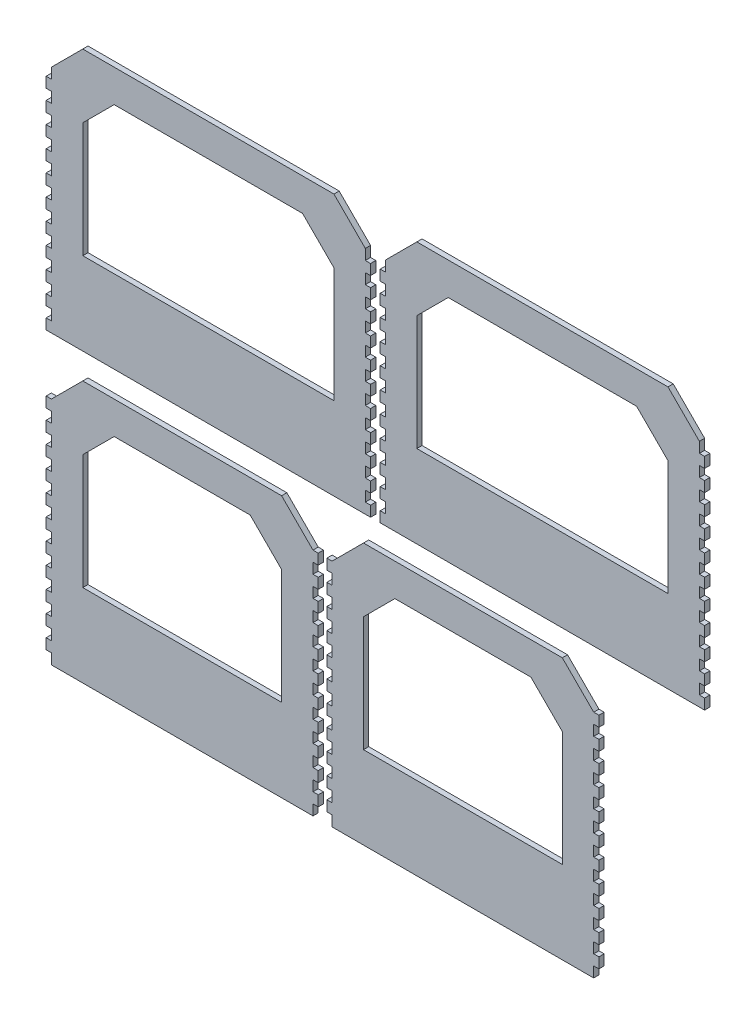
from build123d import *

# Parameters (mm, degrees)
AUFSATZ_LINEAR_AUSTRAGEN9_DEPTH   = 5
AUFSATZ_LINEAR_AUSTRAGEN9_2_DEPTH = 5
AUFSATZ_LINEAR_AUSTRAGEN9_3_DEPTH = 5
AUFSATZ_LINEAR_AUSTRAGEN9_4_DEPTH = 5


with BuildPart() as part:
    # Skizze1 → Aufsatz-Linear austragen9 (new body)
    with BuildSketch(Plane.XY):
        Polygon((430.89618142, 326.340211581), (430.89618142, 336.340211581), (425.89618142, 336.340211581), (425.89618142, 346.340211581), (430.89618142, 346.340211581), (430.89618142, 356.340211581), (425.89618142, 356.340211581), (425.89618142, 366.340211581), (430.89618142, 366.340211581), (430.89618142, 376.340211581), (425.89618142, 376.340211581), (425.89618142, 386.340211581), (430.89618142, 386.340211581), (430.89618142, 396.340211581), (425.89618142, 396.340211581), (425.89618142, 406.340211581), (430.89618142, 406.340211581), (430.89618142, 416.340211581), (425.89618142, 416.340211581), (425.89618142, 426.340211581), (430.89618142, 426.340211581), (430.89618142, 436.340211581), (425.89618142, 436.340211581), (425.89618142, 446.340211581), (430.89618142, 446.340211581), (430.89618142, 456.340211581), (425.89618142, 456.340211581), (425.89618142, 466.340211581), (430.89618142, 466.340211581), (430.89618142, 476.340211581), (425.89618142, 476.340211581), (425.89618142, 486.340211581), (430.89618142, 486.340211581), (430.89618142, 496.340211581), (425.89618142, 496.340211581), (425.89618142, 506.340211581), (430.89618142, 506.340211581), (430.89618142, 516.340211581), (425.89618142, 516.340211581), (425.89618142, 526.340211581), (430.89618142, 526.340211581), (430.89618142, 536.340211581), (460.89618142, 566.340211581), (700.89618142, 566.340211581), (730.89618142, 536.340211581), (730.89618142, 526.340211581), (735.89618142, 526.340211581), (735.89618142, 516.340211581), (730.89618142, 516.340211581), (730.89618142, 506.340211581), (735.89618142, 506.340211581), (735.89618142, 496.340211581), (730.89618142, 496.340211581), (730.89618142, 486.340211581), (735.89618142, 486.340211581), (735.89618142, 476.340211581), (730.89618142, 476.340211581), (730.89618142, 466.340211581), (735.89618142, 466.340211581), (735.89618142, 456.340211581), (730.89618142, 456.340211581), (730.89618142, 446.340211581), (735.89618142, 446.340211581), (735.89618142, 436.340211581), (730.89618142, 436.340211581), (730.89618142, 426.340211581), (735.89618142, 426.340211581), (735.89618142, 416.340211581), (730.89618142, 416.340211581), (730.89618142, 406.340211581), (735.89618142, 406.340211581), (735.89618142, 396.340211581), (730.89618142, 396.340211581), (730.89618142, 386.340211581), (735.89618142, 386.340211581), (735.89618142, 376.340211581), (730.89618142, 376.340211581), (730.89618142, 366.340211581), (735.89618142, 366.340211581), (735.89618142, 356.340211581), (730.89618142, 356.340211581), (730.89618142, 346.340211581), (735.89618142, 346.340211581), (735.89618142, 336.340211581), (730.89618142, 336.340211581), (730.89618142, 326.340211581), (735.89618142, 326.340211581), (735.89618142, 316.340211581), (730.89618142, 316.340211581), (430.89618142, 316.340211581), (425.89618142, 316.340211581), (425.89618142, 326.340211581), align=None)
        Polygon((700.89618142, 505.311376979), (670.89618142, 535.311376979), (490.89618142, 535.311376979), (460.89618142, 505.311376979), (460.89618142, 395.311376979), (700.89618142, 395.311376979), align=None, mode=Mode.SUBTRACT)
    extrude(amount=AUFSATZ_LINEAR_AUSTRAGEN9_DEPTH)


with BuildPart() as body_2:
    # Skizze1 → Aufsatz-Linear austragen9 2 (new body)
    with BuildSketch(Plane.XY):
        Polygon((1055.129449928, 316.340211581), (1055.129449928, 326.340211581), (1050.129449928, 326.340211581), (1050.129449928, 336.340211581), (1055.129449928, 336.340211581), (1055.129449928, 346.340211581), (1050.129449928, 346.340211581), (1050.129449928, 356.340211581), (1055.129449928, 356.340211581), (1055.129449928, 366.340211581), (1050.129449928, 366.340211581), (1050.129449928, 376.340211581), (1055.129449928, 376.340211581), (1055.129449928, 386.340211581), (1050.129449928, 386.340211581), (1050.129449928, 396.340211581), (1055.129449928, 396.340211581), (1055.129449928, 406.340211581), (1050.129449928, 406.340211581), (1050.129449928, 416.340211581), (1055.129449928, 416.340211581), (1055.129449928, 426.340211581), (1050.129449928, 426.340211581), (1050.129449928, 436.340211581), (1055.129449928, 436.340211581), (1055.129449928, 446.340211581), (1050.129449928, 446.340211581), (1050.129449928, 456.340211581), (1055.129449928, 456.340211581), (1055.129449928, 466.340211581), (1050.129449928, 466.340211581), (1050.129449928, 476.340211581), (1055.129449928, 476.340211581), (1055.129449928, 486.340211581), (1050.129449928, 486.340211581), (1050.129449928, 496.340211581), (1055.129449928, 496.340211581), (1055.129449928, 506.340211581), (1050.129449928, 506.340211581), (1050.129449928, 516.340211581), (1055.129449928, 516.340211581), (1055.129449928, 526.340211581), (1050.129449928, 526.340211581), (1050.129449928, 536.340211581), (1020.129449928, 566.340211581), (780.129449928, 566.340211581), (750.129449928, 536.340211581), (750.129449928, 526.340211581), (745.129449928, 526.340211581), (745.129449928, 516.340211581), (750.129449928, 516.340211581), (750.129449928, 506.340211581), (745.129449928, 506.340211581), (745.129449928, 496.340211581), (750.129449928, 496.340211581), (750.129449928, 486.340211581), (745.129449928, 486.340211581), (745.129449928, 476.340211581), (750.129449928, 476.340211581), (750.129449928, 466.340211581), (745.129449928, 466.340211581), (745.129449928, 456.340211581), (750.129449928, 456.340211581), (750.129449928, 446.340211581), (745.129449928, 446.340211581), (745.129449928, 436.340211581), (750.129449928, 436.340211581), (750.129449928, 426.340211581), (745.129449928, 426.340211581), (745.129449928, 416.340211581), (750.129449928, 416.340211581), (750.129449928, 406.340211581), (745.129449928, 406.340211581), (745.129449928, 396.340211581), (750.129449928, 396.340211581), (750.129449928, 386.340211581), (745.129449928, 386.340211581), (745.129449928, 376.340211581), (750.129449928, 376.340211581), (750.129449928, 366.340211581), (745.129449928, 366.340211581), (745.129449928, 356.340211581), (750.129449928, 356.340211581), (750.129449928, 346.340211581), (745.129449928, 346.340211581), (745.129449928, 336.340211581), (750.129449928, 336.340211581), (750.129449928, 326.340211581), (745.129449928, 326.340211581), (745.129449928, 316.340211581), (750.129449928, 316.340211581), (1050.129449928, 316.340211581), align=None)
        Polygon((1020.129449928, 395.311376979), (1020.129449928, 505.311376979), (990.129449928, 535.311376979), (810.129449928, 535.311376979), (780.129449928, 505.311376979), (780.129449928, 395.311376979), align=None, mode=Mode.SUBTRACT)
    extrude(amount=AUFSATZ_LINEAR_AUSTRAGEN9_2_DEPTH)


with BuildPart() as body_3:
    # Skizze1 → Aufsatz-Linear austragen9 3 (new body)
    with BuildSketch(Plane.XY):
        Polygon((460.89618142, 291.663856447), (650.89618142, 291.663856447), (680.89618142, 261.663856447), (685.89618142, 261.663856447), (685.89618142, 251.663856447), (680.89618142, 251.663856447), (680.89618142, 241.663856447), (685.89618142, 241.663856447), (685.89618142, 231.663856447), (680.89618142, 231.663856447), (680.89618142, 221.663856447), (685.89618142, 221.663856447), (685.89618142, 211.663856447), (680.89618142, 211.663856447), (680.89618142, 201.663856447), (685.89618142, 201.663856447), (685.89618142, 191.663856447), (680.89618142, 191.663856447), (680.89618142, 181.663856447), (685.89618142, 181.663856447), (685.89618142, 171.663856447), (680.89618142, 171.663856447), (680.89618142, 161.663856447), (685.89618142, 161.663856447), (685.89618142, 151.663856447), (680.89618142, 151.663856447), (680.89618142, 141.663856447), (685.89618142, 141.663856447), (685.89618142, 131.663856447), (680.89618142, 131.663856447), (680.89618142, 121.663856447), (685.89618142, 121.663856447), (685.89618142, 111.663856447), (680.89618142, 111.663856447), (680.89618142, 101.663856447), (685.89618142, 101.663856447), (685.89618142, 91.663856447), (680.89618142, 91.663856447), (680.89618142, 81.663856447), (685.89618142, 81.663856447), (685.89618142, 71.663856447), (680.89618142, 71.663856447), (680.89618142, 61.663856447), (685.89618142, 61.663856447), (685.89618142, 51.663856447), (680.89618142, 51.663856447), (680.89618142, 41.663856447), (430.89618142, 41.663856447), (430.89618142, 51.663856447), (425.89618142, 51.663856447), (425.89618142, 61.663856447), (430.89618142, 61.663856447), (430.89618142, 71.663856447), (425.89618142, 71.663856447), (425.89618142, 81.663856447), (430.89618142, 81.663856447), (430.89618142, 91.663856447), (425.89618142, 91.663856447), (425.89618142, 101.663856447), (430.89618142, 101.663856447), (430.89618142, 111.663856447), (425.89618142, 111.663856447), (425.89618142, 121.663856447), (430.89618142, 121.663856447), (430.89618142, 131.663856447), (425.89618142, 131.663856447), (425.89618142, 141.663856447), (430.89618142, 141.663856447), (430.89618142, 151.663856447), (425.89618142, 151.663856447), (425.89618142, 161.663856447), (430.89618142, 161.663856447), (430.89618142, 171.663856447), (425.89618142, 171.663856447), (425.89618142, 181.663856447), (430.89618142, 181.663856447), (430.89618142, 191.663856447), (425.89618142, 191.663856447), (425.89618142, 201.663856447), (430.89618142, 201.663856447), (430.89618142, 211.663856447), (425.89618142, 211.663856447), (425.89618142, 221.663856447), (430.89618142, 221.663856447), (430.89618142, 231.663856447), (425.89618142, 231.663856447), (425.89618142, 241.663856447), (430.89618142, 241.663856447), (430.89618142, 251.663856447), (425.89618142, 251.663856447), (425.89618142, 261.663856447), (430.89618142, 261.663856447), align=None)
        Polygon((490.89618142, 260.635021844), (620.89618142, 260.635021844), (650.89618142, 230.635021844), (650.89618142, 120.635021844), (460.89618142, 120.635021844), (460.89618142, 230.635021844), align=None, mode=Mode.SUBTRACT)
    extrude(amount=AUFSATZ_LINEAR_AUSTRAGEN9_3_DEPTH)


with BuildPart() as body_4:
    # Skizze1 → Aufsatz-Linear austragen9 4 (new body)
    with BuildSketch(Plane.XY):
        Polygon((954.144746666, 261.663856447), (954.144746666, 251.663856447), (949.144746666, 251.663856447), (949.144746666, 241.663856447), (954.144746666, 241.663856447), (954.144746666, 231.663856447), (949.144746666, 231.663856447), (949.144746666, 221.663856447), (954.144746666, 221.663856447), (954.144746666, 211.663856447), (949.144746666, 211.663856447), (949.144746666, 201.663856447), (954.144746666, 201.663856447), (954.144746666, 191.663856447), (949.144746666, 191.663856447), (949.144746666, 181.663856447), (954.144746666, 181.663856447), (954.144746666, 171.663856447), (949.144746666, 171.663856447), (949.144746666, 161.663856447), (954.144746666, 161.663856447), (954.144746666, 151.663856447), (949.144746666, 151.663856447), (949.144746666, 141.663856447), (954.144746666, 141.663856447), (954.144746666, 131.663856447), (949.144746666, 131.663856447), (949.144746666, 121.663856447), (954.144746666, 121.663856447), (954.144746666, 111.663856447), (949.144746666, 111.663856447), (949.144746666, 101.663856447), (954.144746666, 101.663856447), (954.144746666, 91.663856447), (949.144746666, 91.663856447), (949.144746666, 81.663856447), (954.144746666, 81.663856447), (954.144746666, 71.663856447), (949.144746666, 71.663856447), (949.144746666, 61.663856447), (954.144746666, 61.663856447), (954.144746666, 51.663856447), (949.144746666, 51.663856447), (949.144746666, 41.663856447), (699.144746666, 41.663856447), (699.144746666, 51.663856447), (694.144746666, 51.663856447), (694.144746666, 61.663856447), (699.144746666, 61.663856447), (699.144746666, 71.663856447), (694.144746666, 71.663856447), (694.144746666, 81.663856447), (699.144746666, 81.663856447), (699.144746666, 91.663856447), (694.144746666, 91.663856447), (694.144746666, 101.663856447), (699.144746666, 101.663856447), (699.144746666, 111.663856447), (694.144746666, 111.663856447), (694.144746666, 121.663856447), (699.144746666, 121.663856447), (699.144746666, 131.663856447), (694.144746666, 131.663856447), (694.144746666, 141.663856447), (699.144746666, 141.663856447), (699.144746666, 151.663856447), (694.144746666, 151.663856447), (694.144746666, 161.663856447), (699.144746666, 161.663856447), (699.144746666, 171.663856447), (694.144746666, 171.663856447), (694.144746666, 181.663856447), (699.144746666, 181.663856447), (699.144746666, 191.663856447), (694.144746666, 191.663856447), (694.144746666, 201.663856447), (699.144746666, 201.663856447), (699.144746666, 211.663856447), (694.144746666, 211.663856447), (694.144746666, 221.663856447), (699.144746666, 221.663856447), (699.144746666, 231.663856447), (694.144746666, 231.663856447), (694.144746666, 241.663856447), (699.144746666, 241.663856447), (699.144746666, 251.663856447), (694.144746666, 251.663856447), (694.144746666, 261.663856447), (699.144746666, 261.663856447), (729.144746666, 291.663856447), (919.144746666, 291.663856447), (949.144746666, 261.663856447), align=None)
        Polygon((729.144746666, 120.635021844), (729.144746666, 230.635021844), (759.144746666, 260.635021844), (889.144746666, 260.635021844), (919.144746666, 230.635021844), (919.144746666, 120.635021844), align=None, mode=Mode.SUBTRACT)
    extrude(amount=AUFSATZ_LINEAR_AUSTRAGEN9_4_DEPTH)


solid = Compound([part.part, body_2.part, body_3.part, body_4.part])
